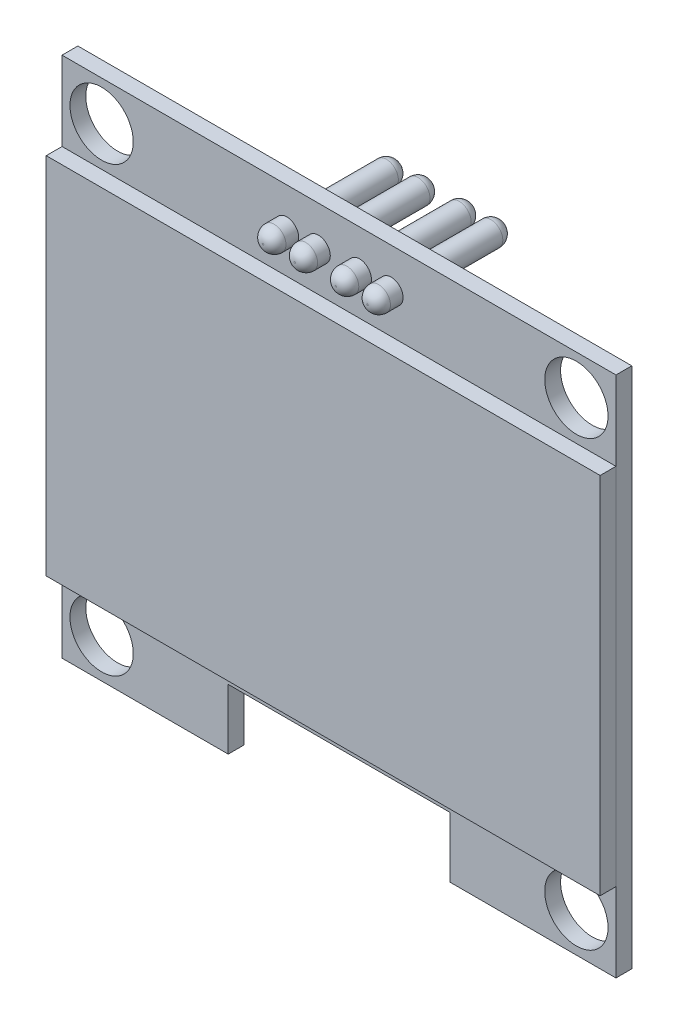
from build123d import *

# Parameters (mm, degrees)
SKETCH1_R                = 2
BOSS_EXTRUDE1_DEPTH      = 1
SKETCH2_W                = 35
SKETCH2_H                = 23
BOSS_EXTRUDE2_DEPTH      = 1
BOSS_EXTRUDE3_DEPTH      = 0.5
BOSS_EXTRUDE3_DEPTH_BACK = 8
SKETCH3_R                = 0.75
FILLET1_R                = 0.7


with BuildPart() as part:
    # Sketch1 → Boss-Extrude1 (new body)
    with BuildSketch(Plane.XY):
        Polygon((-17.5, -16.5), (-7, -16.5), (-7, -12.68307554), (7, -12.68307554), (7, -16.5), (17.5, -16.5), (17.5, 16.5), (-17.5, 16.5), align=None)
        with Locations((-15, 14)):
            Circle(SKETCH1_R, mode=Mode.SUBTRACT)
        with Locations(Location((15, 14, 0), (0, 0, 180))):
            Circle(SKETCH1_R, mode=Mode.SUBTRACT)
        with Locations((15, -14)):
            Circle(SKETCH1_R, mode=Mode.SUBTRACT)
        with Locations(Location((-15, -14, 0), (0, 0, 180))):
            Circle(SKETCH1_R, mode=Mode.SUBTRACT)
    extrude(amount=BOSS_EXTRUDE1_DEPTH)

    # Sketch3 → Boss-Extrude3 (add, two sides: drawn at the far end of the back side and taken through both)
    with BuildSketch(Plane.XY.offset(2).offset(-BOSS_EXTRUDE3_DEPTH_BACK)):
        with Locations((-1.3, 14)):
            Circle(SKETCH3_R)
        with Locations((-3.3, 14)):
            Circle(SKETCH3_R)
        with Locations(Location((1.3, 14, 0), (0, 0, 180))):
            Circle(SKETCH3_R)
        with Locations(Location((3.3, 14, 0), (0, 0, 180))):
            Circle(SKETCH3_R)
    extrude(amount=BOSS_EXTRUDE3_DEPTH + BOSS_EXTRUDE3_DEPTH_BACK)

    # Fillet1
    fillet1_edges = [part.edges().sort_by_distance(p)[0] for p in [
        (-2.05, 14, -6),
        (-2.05, 14, 2.5),
        (-4.05, 14, -6),
        (-4.05, 14, 2.5),
        (2.05, 14, -6),
        (2.05, 14, 2.5),
        (4.05, 14, -6),
        (4.05, 14, 2.5),
    ]]
    fillet(fillet1_edges, radius=FILLET1_R)


with BuildPart() as body_2:
    # Sketch2 → Boss-Extrude2 (new body)
    with BuildSketch(Plane.XY.offset(1)):
        Rectangle(SKETCH2_W, SKETCH2_H)
    extrude(amount=BOSS_EXTRUDE2_DEPTH)


solid = Compound([part.part, body_2.part])
